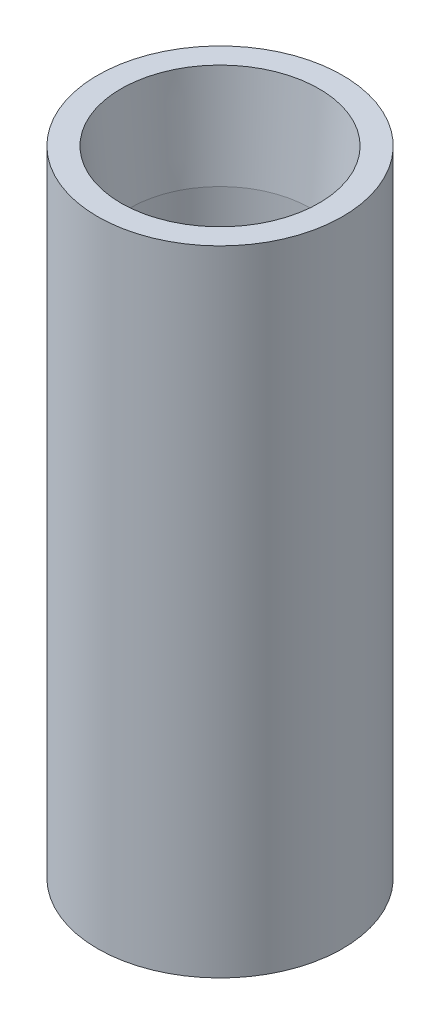
from build123d import *

# Parameters (mm, degrees)
SKETCH1_R           = 12.7
BOSS_EXTRUDE1_DEPTH = 12.7
BOSS_EXTRUDE1_DRAFT = -5
SKETCH2_R           = 3.175
CUT_EXTRUDE1_DEPTH  = 22.997045256
SKETCH7_R           = 1.27
CUT_EXTRUDE2_DEPTH  = 7.62
SKETCH10_R          = 15.7
BOSS_EXTRUDE2_DEPTH = 81.28
SKETCH11_R          = 12.7
CUT_EXTRUDE3_DEPTH  = 12.7
CUT_EXTRUDE3_DRAFT  = -5
SKETCH12_R          = 11.588893973
CUT_EXTRUDE4_DEPTH  = 63.5


with BuildPart() as part:
    # Sketch1 → Boss-Extrude1 (with draft: the straight prism first)
    with BuildSketch(Plane(origin=(0, 0, 0), x_dir=(1, 0, 0), z_dir=(0, 1, 0))):
        Circle(SKETCH1_R)
    extrude(amount=-BOSS_EXTRUDE1_DEPTH)
    # Boss-Extrude1: the draft: its side faces are tilted about the plane it starts from
    boss_extrude1_sides = [part.faces().sort_by_distance(p)[0] for p in [
        (-12.7, -6.35, 0),
    ]]
    draft(boss_extrude1_sides, Plane(origin=(0, 0, 0), x_dir=(1, 0, 0), z_dir=(0, 1, 0)), BOSS_EXTRUDE1_DRAFT)

    # Sketch2 → Cut-Extrude1 (cut, through all)
    with BuildSketch(Plane(origin=(0, 0, 0), x_dir=(1, 0, 0), z_dir=(0, 1, 0))):
        with Locations(Location((0, 0, 0), (0, 0, 270))):
            Circle(SKETCH2_R)
    extrude(amount=-CUT_EXTRUDE1_DEPTH, mode=Mode.SUBTRACT)

    # Sketch7 → Cut-Extrude2 (cut)
    with BuildSketch(Plane.XZ.offset(12.7)):
        with Locations(Location((-8.636, 0, 0), (0, 0, 270))):
            Circle(SKETCH7_R)
        with Locations(Location((4.318, 7.478995387, 0), (0, 0, 270))):
            Circle(SKETCH7_R)
    extrude(amount=-CUT_EXTRUDE2_DEPTH, mode=Mode.SUBTRACT)

    # Sketch10 → Boss-Extrude2 (add)
    with BuildSketch(Plane(origin=(0, 0, 0), x_dir=(1, 0, 0), z_dir=(0, 1, 0))):
        with Locations(Location((0, 0, 0), (0, 0, 270))):
            Circle(SKETCH10_R)
    extrude(amount=-BOSS_EXTRUDE2_DEPTH)


with BuildPart() as cut_extrude3_tool:
    # Sketch11 → Cut-Extrude3 (with draft: the straight prism first)
    with BuildSketch(Plane(origin=(0, 0, 0), x_dir=(1, 0, 0), z_dir=(0, 1, 0))):
        Circle(SKETCH11_R)
    extrude(amount=-CUT_EXTRUDE3_DEPTH)
    # Cut-Extrude3: the draft: its side faces are tilted about the plane it starts from
    cut_extrude3_sides = [cut_extrude3_tool.faces().sort_by_distance(p)[0] for p in [
        (-12.7, -6.35, 0),
    ]]
    draft(cut_extrude3_sides, Plane(origin=(0, 0, 0), x_dir=(1, 0, 0), z_dir=(0, 1, 0)), CUT_EXTRUDE3_DRAFT)


with BuildPart() as part_1:
    add(part.part)

    # Cut-Extrude3: cut by cut_extrude3_tool
    add(cut_extrude3_tool.part, mode=Mode.SUBTRACT)

    # Sketch12 → Cut-Extrude4 (cut)
    with BuildSketch(Plane(origin=(0, -12.7, 0), x_dir=(1, 0, 0), z_dir=(0, 1, 0))):
        with Locations(Location((0, 0, 0), (0, 0, 270))):
            Circle(SKETCH12_R)
    extrude(amount=-CUT_EXTRUDE4_DEPTH, mode=Mode.SUBTRACT)


solid = part_1.part
